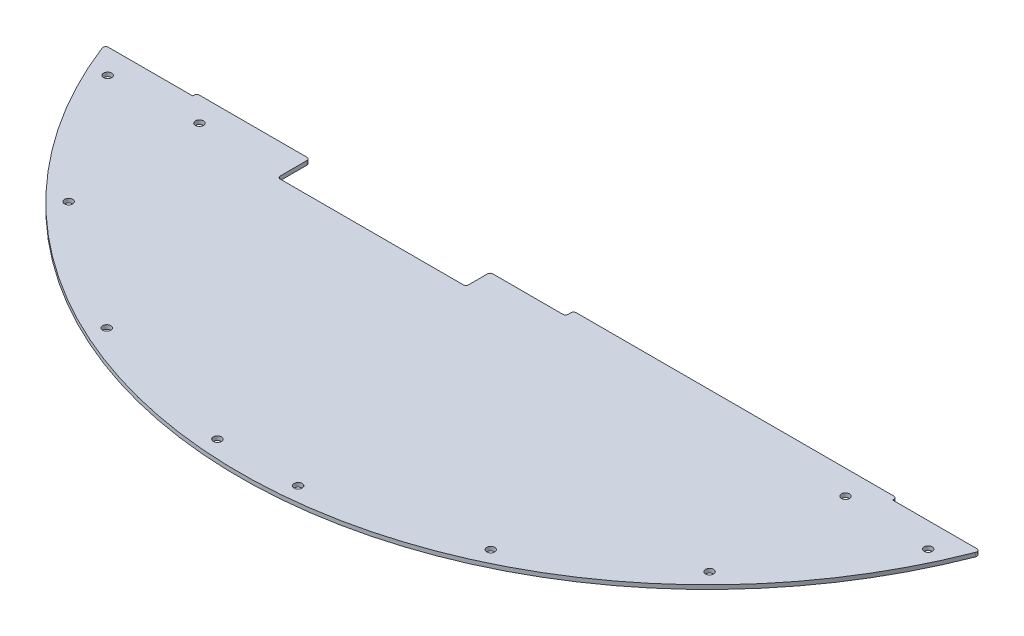
from build123d import *

# Parameters (mm, degrees)
ESQUISSE1_R                  = 1.5
BOSS_EXTRU_1_DEPTH           = 1.5
CONG_2_R                     = 1
ESQUISSE2_R                  = 1.5
ENL_V_MAT_EXTRU_1_DEPTH      = 238.959306119
R_P_TITION_CIRCULAIRE1_COUNT = 4
R_P_TITION_CIRCULAIRE1_ANGLE = 60
SYM_TRIE1_COPY_1_SKETCH_R    = 1.5
SYM_TRIE1_COPY_1_DEPTH       = 238.959306119
SYM_TRIE1_COPY_2_SKETCH_R    = 1.5
SYM_TRIE1_COPY_2_DEPTH       = 238.959306119
SYM_TRIE1_COPY_3_SKETCH_R    = 1.5
SYM_TRIE1_COPY_3_DEPTH       = 238.959306119
ENL_V_MAT_EXTRU_2_DEPTH      = 238.959306119
CONG_3_R                     = 1


with BuildPart() as part:
    # Esquisse1 → Boss.-Extru.1 (new body)
    with BuildSketch(Plane(origin=(0, 0, 0), x_dir=(1, 0, 0), z_dir=(0, 1, 0))):
        with BuildLine():
            Line((-130, -60), (130, -60))
            Line((130, -60), (130, -61.5))
            Line((130, -61.5), (162.769008107, -61.5))
            ThreePointArc((162.769008107, -61.5), (98.931794687, -143.138045257), (0, -174))
            ThreePointArc((0, -174), (-98.931794687, -143.138045257), (-162.769008107, -61.5))
            Line((-162.769008107, -61.5), (-130, -61.5))
            Line((-130, -61.5), (-130, -60))
        make_face()
        with Locations(Location((-120, -69, 0), (0, 0, 270))):
            Circle(ESQUISSE1_R, mode=Mode.SUBTRACT)
        with Locations(Location((120, -69, 0), (0, 0, 90))):
            Circle(ESQUISSE1_R, mode=Mode.SUBTRACT)
    extrude(amount=BOSS_EXTRU_1_DEPTH)

    # Congé2
    cong_2_edges = [part.edges().sort_by_distance(p)[0] for p in [
        (-130, 0.75, 60),
        (130, 0.75, 60),
        (162.769008107, 0.75, 61.5),
        (-162.769008107, 0.75, 61.5),
    ]]
    fillet(cong_2_edges, radius=CONG_2_R)

    # Esquisse2 → Enlèv. mat.-Extru.1 (cut, through all)
    with BuildSketch(Plane(origin=(0, 1.5, 0), x_dir=(1, 0, 0), z_dir=(0, 1, 0))):
        with Locations(Location((-15, -167.329017209, 0), (0, 0, 270))):
            Circle(ESQUISSE2_R)
    enl_v_mat_extru_1 = extrude(amount=-ENL_V_MAT_EXTRU_1_DEPTH, mode=Mode.SUBTRACT)

    # Répétition circulaire1: Enlèv. mat.-Extru.1 ×4 about axis
    r_p_tition_circulaire1_axis = Axis((0, 0, 0), (0, -1, 0))
    for i in range(1, R_P_TITION_CIRCULAIRE1_COUNT):
        add(enl_v_mat_extru_1.rotate(r_p_tition_circulaire1_axis, i * R_P_TITION_CIRCULAIRE1_ANGLE / (R_P_TITION_CIRCULAIRE1_COUNT - 1)), mode=Mode.SUBTRACT)

    # Symétrie1: Enlèv. mat.-Extru.1 across plane
    add(enl_v_mat_extru_1.mirror(Plane(origin=(0, 0, 0), x_dir=(0, 0, 1), z_dir=(1, 0, 0))), mode=Mode.SUBTRACT)

    # Symétrie1 copy 1 sketch → Symétrie1 copy 1 (cut, through all)
    with BuildSketch(Plane(origin=(0, 1.5, 0), x_dir=(-0.9396926207859081, 0, 0.3420201433256695), z_dir=(0, 1, 0))):
        with Locations((-15, 167.329017209)):
            Circle(SYM_TRIE1_COPY_1_SKETCH_R)
    extrude(amount=-SYM_TRIE1_COPY_1_DEPTH, mode=Mode.SUBTRACT)

    # Symétrie1 copy 2 sketch → Symétrie1 copy 2 (cut, through all)
    with BuildSketch(Plane(origin=(0, 1.5, 0), x_dir=(-0.766044443118977, 0, 0.6427876096865406), z_dir=(0, 1, 0))):
        with Locations((-15, 167.329017209)):
            Circle(SYM_TRIE1_COPY_2_SKETCH_R)
    extrude(amount=-SYM_TRIE1_COPY_2_DEPTH, mode=Mode.SUBTRACT)

    # Symétrie1 copy 3 sketch → Symétrie1 copy 3 (cut, through all)
    with BuildSketch(Plane(origin=(0, 1.5, 0), x_dir=(-0.4999999999999978, 0, 0.8660254037844399), z_dir=(0, 1, 0))):
        with Locations((-15, 167.329017209)):
            Circle(SYM_TRIE1_COPY_3_SKETCH_R)
    extrude(amount=-SYM_TRIE1_COPY_3_DEPTH, mode=Mode.SUBTRACT)

    # Esquisse3 → Enlèv. mat.-Extru.2 (cut, through all)
    with BuildSketch(Plane(origin=(0, 1.5, 0), x_dir=(1, 0, 0), z_dir=(0, 1, 0))):
        Polygon((-88, -60), (10, -60), (10, -63), (-18, -63), (-18, -72), (-88, -72), align=None)
    extrude(amount=-ENL_V_MAT_EXTRU_2_DEPTH, mode=Mode.SUBTRACT)

    # Congé3
    cong_3_edges = [part.edges().sort_by_distance(p)[0] for p in [
        (-18, 0.75, 72),
        (-88, 0.75, 72),
        (-88, 0.75, 60),
        (10, 0.75, 60),
        (10, 0.75, 63),
        (-18, 0.75, 63),
    ]]
    fillet(cong_3_edges, radius=CONG_3_R)


solid = part.part
